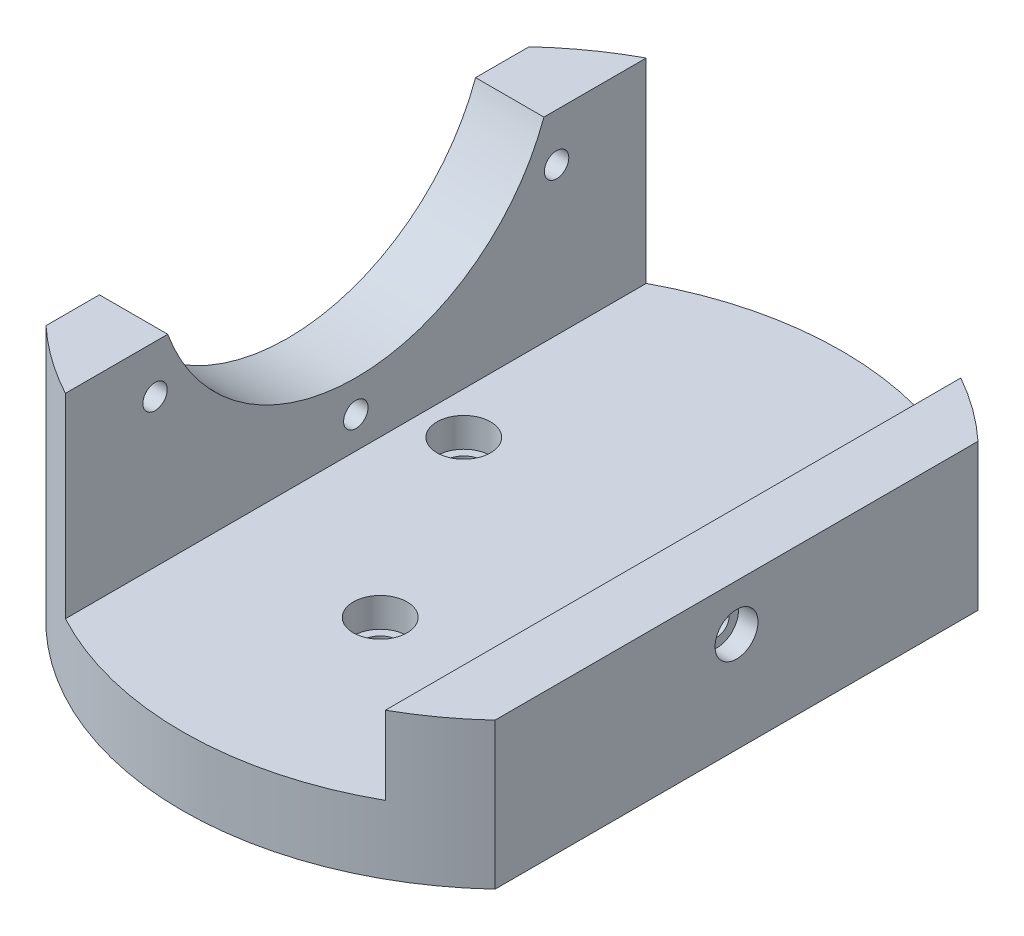
from build123d import *

# Parameters (mm, degrees)
SKETCH8_R            = 1.912019499
BOSS_EXTRUDE7_DEPTH  = 7
SKETCH9_R            = 2.75
CUT_EXTRUDE4_DEPTH   = 3
BOSS_EXTRUDE9_DEPTH  = 20
SKETCH13_R           = 20.5
CUT_EXTRUDE7_DEPTH   = 19.5
SKETCH14_R           = 1.25
CUT_EXTRUDE8_DEPTH   = 19.5
SKETCH15_R           = 2.2
CUT_EXTRUDE9_DEPTH   = 2
BOSS_EXTRUDE10_DEPTH = 8
SKETCH17_R           = 1.25
CUT_EXTRUDE10_DEPTH  = 7.5
CUT_EXTRUDE11_START  = -2
SKETCH18_R           = 2.2
CUT_EXTRUDE11_DEPTH  = 2


with BuildPart() as part:
    # Sketch8 → Boss-Extrude7 (new body)
    with BuildSketch(Plane(origin=(0, 0, 0), x_dir=(1, 0, 0), z_dir=(0, 1, 0))):
        with BuildLine():
            Line((-23, 24.739070187), (-23, -24.739070187))
            ThreePointArc((-23, -24.739070187), (0, -33.779011142), (23, -24.739070187))
            Line((23, -24.739070187), (23, 24.739070187))
            ThreePointArc((23, 24.739070187), (0, 33.779011142), (-23, 24.739070187))
        make_face()
        with Locations(Location((11.691342951, 6.75, 0), (0, 0, 270))):
            Circle(SKETCH8_R, mode=Mode.SUBTRACT)
        with Locations(Location((0, -13.5, 0), (0, 0, 270))):
            Circle(SKETCH8_R, mode=Mode.SUBTRACT)
        with Locations(Location((-11.691342951, 6.75, 0), (0, 0, 270))):
            Circle(SKETCH8_R, mode=Mode.SUBTRACT)
    extrude(amount=BOSS_EXTRUDE7_DEPTH)

    # Sketch9 → Cut-Extrude4 (cut)
    with BuildSketch(Plane(origin=(0, 7, 0), x_dir=(1, 0, 0), z_dir=(0, 1, 0))):
        with Locations(Location((-11.691342951, 6.75, 0), (0, 0, 270))):
            Circle(SKETCH9_R)
        with Locations(Location((11.691342951, 6.75, 0), (0, 0, 270))):
            Circle(SKETCH9_R)
        with Locations(Location((0, -13.5, 0), (0, 0, 270))):
            Circle(SKETCH9_R)
    extrude(amount=-CUT_EXTRUDE4_DEPTH, mode=Mode.SUBTRACT)

    # Sketch12 → Boss-Extrude9 (add)
    with BuildSketch(Plane(origin=(0, 7, 0), x_dir=(1, 0, 0), z_dir=(0, 1, 0))):
        with BuildLine():
            Line((-16, 29.749312491), (-16, -29.749312491))
            ThreePointArc((-16, -29.749312491), (-19.660255135, -27.468089881), (-23, -24.739070187))
            Line((-23, -24.739070187), (-23, 24.739070187))
            ThreePointArc((-23, 24.739070187), (-19.660255135, 27.468089881), (-16, 29.749312491))
        make_face()
    extrude(amount=BOSS_EXTRUDE9_DEPTH)

    # Sketch13 → Cut-Extrude7 (cut)
    with BuildSketch(Plane(origin=(-16, 0, 0), x_dir=(0, 0, -1), z_dir=(1, 0, 0))):
        with Locations((0, 34)):
            Circle(SKETCH13_R)
    extrude(amount=-CUT_EXTRUDE7_DEPTH, mode=Mode.SUBTRACT)

    # Sketch14 → Cut-Extrude8 (cut)
    with BuildSketch(Plane(origin=(-16, 0, 0), x_dir=(0, 0, -1), z_dir=(1, 0, 0))):
        with Locations((0, 10.25)):
            Circle(SKETCH14_R)
        with Locations((-20.56810334, 22.125)):
            Circle(SKETCH14_R)
        with Locations((20.56810334, 22.125)):
            Circle(SKETCH14_R)
    extrude(amount=-CUT_EXTRUDE8_DEPTH, mode=Mode.SUBTRACT)

    # Sketch15 → Cut-Extrude9 (cut)
    with BuildSketch(Plane.ZY.offset(23)):
        with Locations((0, 10.25)):
            Circle(SKETCH15_R)
        with Locations((-20.56810334, 22.125)):
            Circle(SKETCH15_R)
        with Locations((20.56810334, 22.125)):
            Circle(SKETCH15_R)
    extrude(amount=-CUT_EXTRUDE9_DEPTH, mode=Mode.SUBTRACT)

    # Sketch16 → Boss-Extrude10 (add)
    with BuildSketch(Plane(origin=(0, 7, 0), x_dir=(1, 0, 0), z_dir=(0, 1, 0))):
        with BuildLine():
            Line((16.5, 29.474931615), (16.5, -29.474931615))
            ThreePointArc((16.5, -29.474931615), (19.891445294, -27.301135468), (23, -24.739070187))
            Line((23, -24.739070187), (23, 24.739070187))
            ThreePointArc((23, 24.739070187), (19.891445294, 27.301135468), (16.5, 29.474931615))
        make_face()
    extrude(amount=BOSS_EXTRUDE10_DEPTH)

    # Sketch17 → Cut-Extrude10 (cut)
    with BuildSketch(Plane(origin=(23, 0, 0), x_dir=(0, 0, -1), z_dir=(1, 0, 0))):
        with Locations((0, 10.25)):
            Circle(SKETCH17_R)
    extrude(amount=-CUT_EXTRUDE10_DEPTH, mode=Mode.SUBTRACT)

    # Sketch18 → Cut-Extrude11 (cut)
    with BuildSketch(Plane(origin=(23, 0, 0), x_dir=(0, 0, -1), z_dir=(1, 0, 0)).offset(CUT_EXTRUDE11_START)):
        with Locations(Location((0, 10.25, 0), (0, 0, 180))):
            Circle(SKETCH18_R)
    extrude(amount=CUT_EXTRUDE11_DEPTH, mode=Mode.SUBTRACT)


solid = part.part
